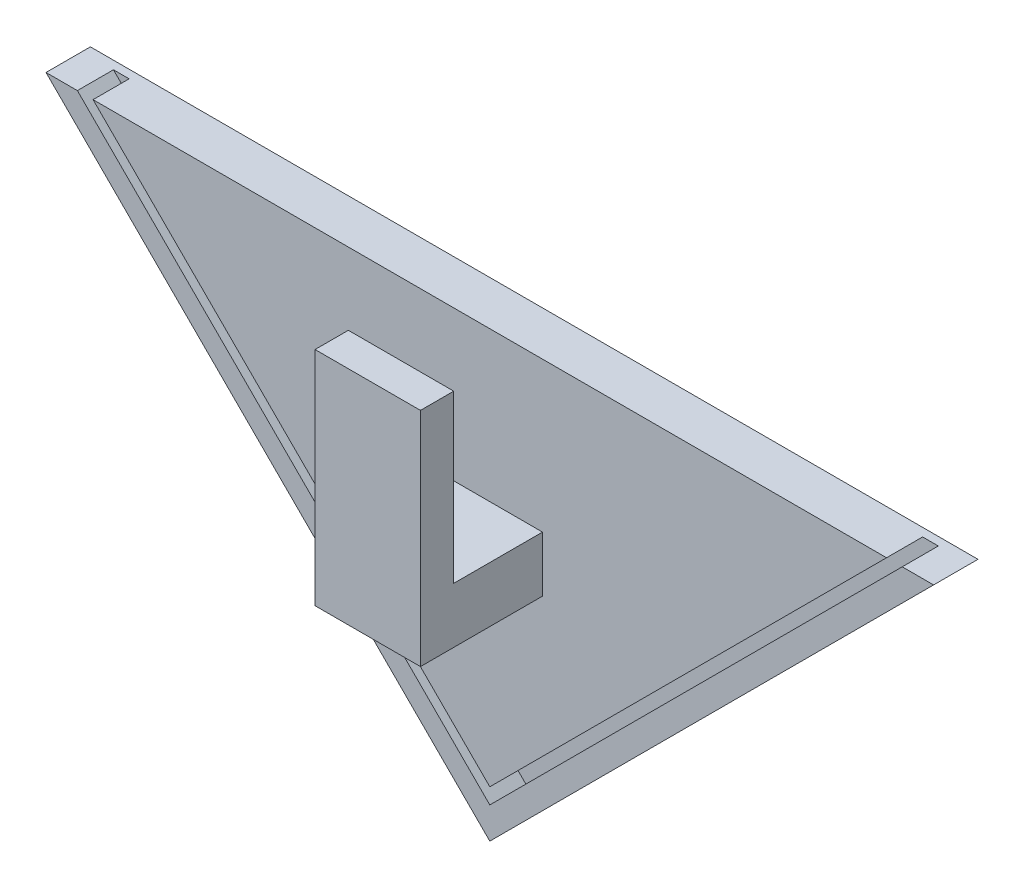
from build123d import *

# Parameters (mm, degrees)
BOSS_EXTRUDE1_DEPTH = 4
CUT_EXTRUDE2_DEPTH  = 3.25
SKETCH5_W           = 9.5
SKETCH5_H           = 5
BOSS_EXTRUDE2_DEPTH = 8
SKETCH6_W           = 9.5
SKETCH6_H           = 20
BOSS_EXTRUDE3_DEPTH = 3


with BuildPart() as part:
    # Sketch1 → Boss-Extrude1 (new body)
    with BuildSketch(Plane.XY):
        Polygon((0, 0), (40, 40), (-40, 40), align=None)
    extrude(amount=BOSS_EXTRUDE1_DEPTH)

    # Sketch2 → Cut-Extrude2 (cut)
    with BuildSketch(Plane.XY.offset(4)):
        Polygon((0, 2.828427125), (-37.171572875, 40), (-35.757359313, 40), (0, 4.242640687), (35.757359313, 40), (37.171572875, 40), align=None)
    extrude(amount=-CUT_EXTRUDE2_DEPTH, mode=Mode.SUBTRACT)

    # Sketch5 → Boss-Extrude2 (add)
    with BuildSketch(Plane.XY.offset(4)):
        with Locations((0, 24)):
            Rectangle(SKETCH5_W, SKETCH5_H)
    extrude(amount=BOSS_EXTRUDE2_DEPTH)

    # Sketch6 → Boss-Extrude3 (add)
    with BuildSketch(Plane.XY.offset(12)):
        with Locations((0, 31.5)):
            Rectangle(SKETCH6_W, SKETCH6_H)
    extrude(amount=BOSS_EXTRUDE3_DEPTH)


solid = part.part
